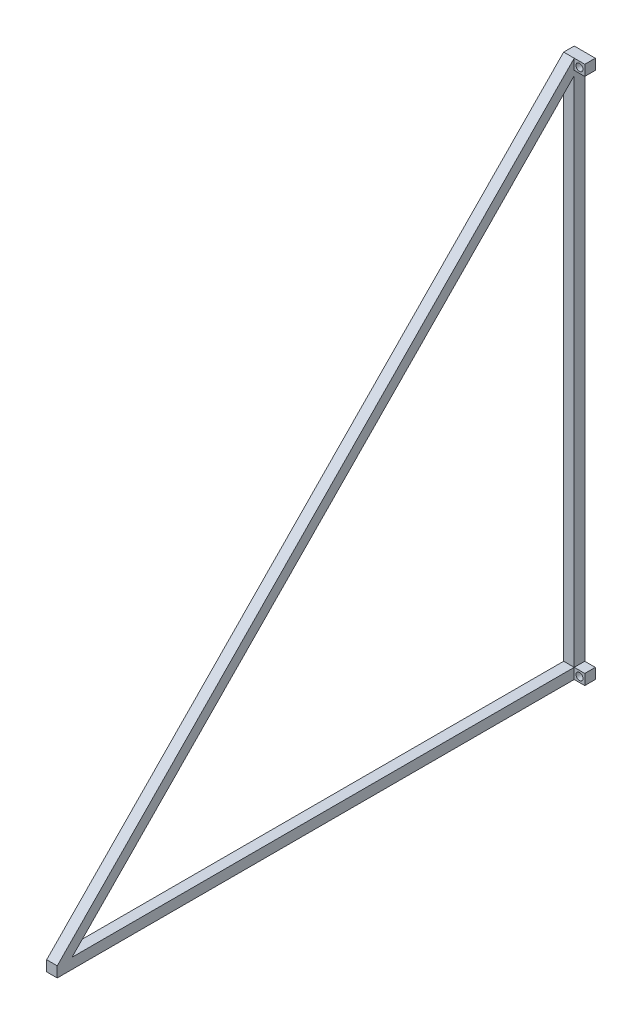
from build123d import *

# Parameters (mm, degrees)
SKICA1_W                = 3
SKICA1_H                = 3
SKICA1_R                = 1
SKICA1_H_2              = 147
P_IDAT_VYSUNUT_M1_DEPTH = 3
P_IDAT_VYSUNUT_M3_DEPTH = 3


with BuildPart() as part:
    # Skica1 → Přidat vysunutím1 (new body)
    # profile 1 of 5: a face of its own
    with BuildSketch(Plane.XY):
        with Locations((4.5, 151.5)):
            Rectangle(SKICA1_W, SKICA1_H)
        with Locations((4.5, 151.5)):
            Circle(SKICA1_R, mode=Mode.SUBTRACT)
    # profile 2 of 5: a face of its own
    with BuildSketch(Plane.XY):
        with Locations((1.5, 151.5)):
            Rectangle(SKICA1_W, SKICA1_H)
    # profile 3 of 5: a face of its own
    with BuildSketch(Plane.XY):
        with Locations((1.5, 76.5)):
            Rectangle(SKICA1_W, SKICA1_H_2)
    # profile 4 of 5: a face of its own
    with BuildSketch(Plane.XY):
        with Locations((1.5, 1.5)):
            Rectangle(SKICA1_W, SKICA1_H)
    # profile 5 of 5: a face of its own
    with BuildSketch(Plane.XY):
        with Locations((4.5, 1.5)):
            Rectangle(SKICA1_W, SKICA1_H)
        with Locations((4.5, 1.5)):
            Circle(SKICA1_R, mode=Mode.SUBTRACT)
    extrude(amount=P_IDAT_VYSUNUT_M1_DEPTH)

    # Skica6 → Přidat vysunutím3 (add)
    with BuildSketch(Plane.ZY):
        Polygon((150, 3), (3, 153), (3, 148.713848419), (145.79957145, 3), (3, 3), (3, 0), (150, 0), align=None)
    extrude(amount=-P_IDAT_VYSUNUT_M3_DEPTH)


solid = part.part
